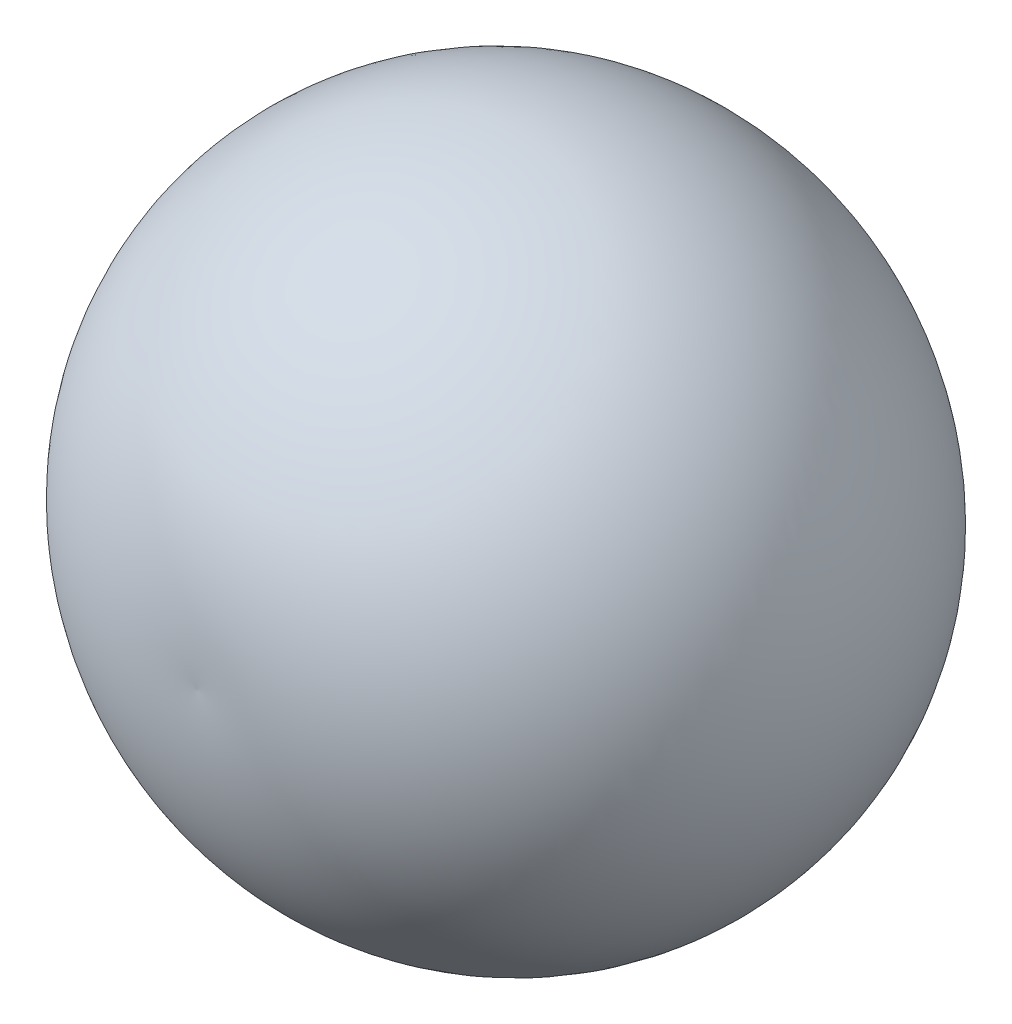
from build123d import *


with BuildPart() as part:
    # Sketch1 → Revolve1 (revolve)
    with BuildSketch(Plane(origin=(0, 0, 0), x_dir=(1, 0, 0), z_dir=(0, 1, 0))):
        with BuildLine():
            Line((-0.543618308, 7.480272665), (-0.543618308, -7.480272665))
            ThreePointArc((-0.543618308, -7.480272665), (7.5, 0), (-0.543618308, 7.480272665))
        make_face()
    revolve(axis=Axis((-0.543618308, 0, -7.480272665), (0, 0, 1)))


solid = part.part
